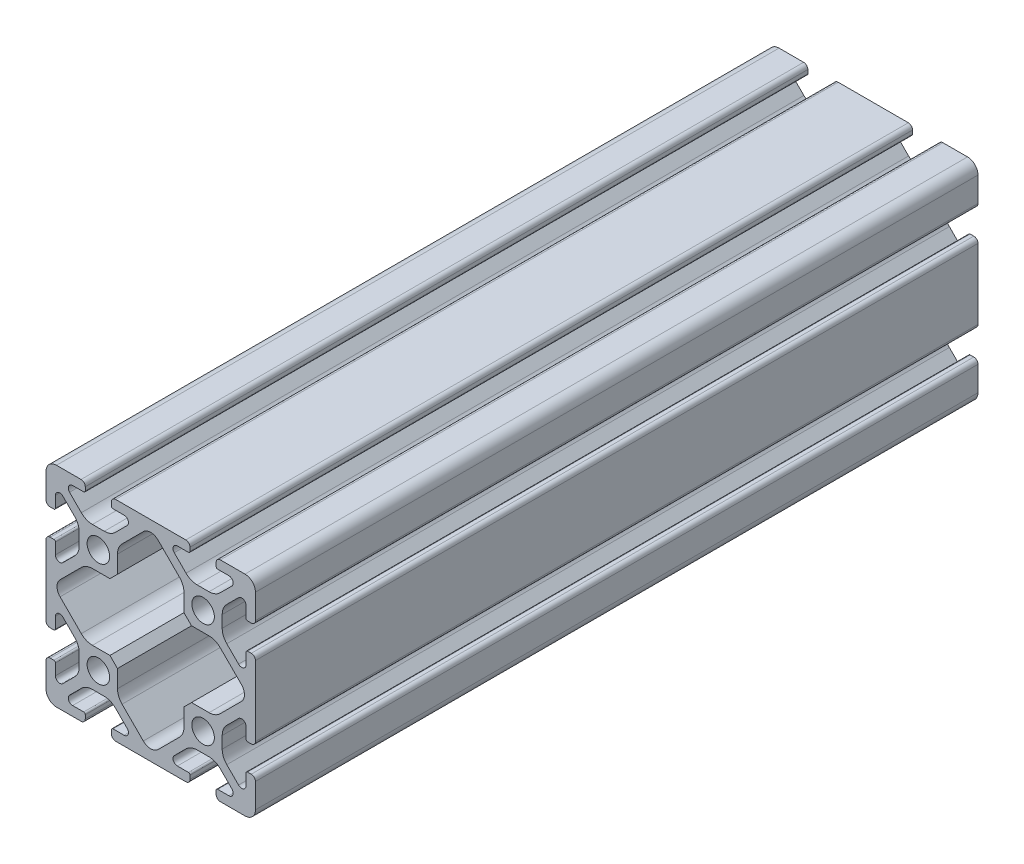
from build123d import *

# Parameters (mm, degrees)
ESQUISSE1_R      = 2.15
EXTRUSION1_DEPTH = 138


with BuildPart() as part:
    # Esquisse1 → Extrusion1 (new body)
    with BuildSketch(Plane(origin=(0, 0, 0), x_dir=(-1, 0, 0), z_dir=(0, 0, -1))):
        with BuildLine():
            Line((0, 13.3), (0, 26.7))
            ThreePointArc((0, 26.7), (-0.234314575, 27.265685425), (-0.8, 27.5))
            Line((-0.8, 27.5), (-1.5, 27.5))
            ThreePointArc((-1.5, 27.5), (-1.712132034, 27.412132034), (-1.8, 27.2))
            Line((-1.8, 27.2), (-1.8, 25.081575939))
            ThreePointArc((-1.8, 25.081575939), (-2.313345604, 24.313299949), (-3.219588924, 24.493562953))
            Line((-3.219588924, 24.493562953), (-5.471320344, 26.745294373))
            ThreePointArc((-5.471320344, 26.745294373), (-6.121638598, 27.718564419), (-6.35, 28.866614716))
            Line((-6.35, 28.866614716), (-6.35, 31.133385284))
            ThreePointArc((-6.35, 31.133385284), (-6.121638598, 32.281435581), (-5.471320344, 33.254705627))
            Line((-5.471320344, 33.254705627), (-3.219588924, 35.506437047))
            ThreePointArc((-3.219588924, 35.506437047), (-2.313345604, 35.686700051), (-1.8, 34.918424061))
            Line((-1.8, 34.918424061), (-1.8, 32.8))
            ThreePointArc((-1.8, 32.8), (-1.712132034, 32.587867966), (-1.5, 32.5))
            Line((-1.5, 32.5), (-0.8, 32.5))
            ThreePointArc((-0.8, 32.5), (-0.234314575, 32.734314575), (0, 33.3))
            Line((0, 33.3), (0, 38))
            ThreePointArc((0, 38), (-0.585786438, 39.414213562), (-2, 40))
            Line((-2, 40), (-6.7, 40))
            ThreePointArc((-6.7, 40), (-7.265685425, 39.765685425), (-7.5, 39.2))
            Line((-7.5, 39.2), (-7.5, 38.5))
            ThreePointArc((-7.5, 38.5), (-7.412132034, 38.287867966), (-7.2, 38.2))
            Line((-7.2, 38.2), (-5.081575939, 38.2))
            ThreePointArc((-5.081575939, 38.2), (-4.313299949, 37.686654396), (-4.493562953, 36.780411076))
            Line((-4.493562953, 36.780411076), (-6.745294373, 34.528679656))
            ThreePointArc((-6.745294373, 34.528679656), (-7.718564419, 33.878361402), (-8.866614716, 33.65))
            Line((-8.866614716, 33.65), (-11.133385284, 33.65))
            ThreePointArc((-11.133385284, 33.65), (-12.281435581, 33.878361402), (-13.254705627, 34.528679656))
            Line((-13.254705627, 34.528679656), (-15.506437047, 36.780411076))
            ThreePointArc((-15.506437047, 36.780411076), (-15.686700051, 37.686654396), (-14.918424061, 38.2))
            Line((-14.918424061, 38.2), (-12.8, 38.2))
            ThreePointArc((-12.8, 38.2), (-12.587867966, 38.287867966), (-12.5, 38.5))
            Line((-12.5, 38.5), (-12.5, 39.2))
            ThreePointArc((-12.5, 39.2), (-12.734314575, 39.765685425), (-13.3, 40))
            Line((-13.3, 40), (-26.7, 40))
            ThreePointArc((-26.7, 40), (-27.265685425, 39.765685425), (-27.5, 39.2))
            Line((-27.5, 39.2), (-27.5, 38.5))
            ThreePointArc((-27.5, 38.5), (-27.412132034, 38.287867966), (-27.2, 38.2))
            Line((-27.2, 38.2), (-25.081575939, 38.2))
            ThreePointArc((-25.081575939, 38.2), (-24.313299949, 37.686654396), (-24.493562953, 36.780411076))
            Line((-24.493562953, 36.780411076), (-26.745294373, 34.528679656))
            ThreePointArc((-26.745294373, 34.528679656), (-27.718564419, 33.878361402), (-28.866614716, 33.65))
            Line((-28.866614716, 33.65), (-31.133385284, 33.65))
            ThreePointArc((-31.133385284, 33.65), (-32.281435581, 33.878361402), (-33.254705627, 34.528679656))
            Line((-33.254705627, 34.528679656), (-35.506437047, 36.780411076))
            ThreePointArc((-35.506437047, 36.780411076), (-35.686700051, 37.686654396), (-34.918424061, 38.2))
            Line((-34.918424061, 38.2), (-32.8, 38.2))
            ThreePointArc((-32.8, 38.2), (-32.587867966, 38.287867966), (-32.5, 38.5))
            Line((-32.5, 38.5), (-32.5, 39.2))
            ThreePointArc((-32.5, 39.2), (-32.734314575, 39.765685425), (-33.3, 40))
            Line((-33.3, 40), (-38, 40))
            ThreePointArc((-38, 40), (-39.414213562, 39.414213562), (-40, 38))
            Line((-40, 38), (-40, 33.3))
            ThreePointArc((-40, 33.3), (-39.765685425, 32.734314575), (-39.2, 32.5))
            Line((-39.2, 32.5), (-38.5, 32.5))
            ThreePointArc((-38.5, 32.5), (-38.287867966, 32.587867966), (-38.2, 32.8))
            Line((-38.2, 32.8), (-38.2, 34.918424061))
            ThreePointArc((-38.2, 34.918424061), (-37.686654396, 35.686700051), (-36.780411076, 35.506437047))
            Line((-36.780411076, 35.506437047), (-34.528679656, 33.254705627))
            ThreePointArc((-34.528679656, 33.254705627), (-33.878361402, 32.281435581), (-33.65, 31.133385284))
            Line((-33.65, 31.133385284), (-33.65, 28.866614716))
            ThreePointArc((-33.65, 28.866614716), (-33.878361402, 27.718564419), (-34.528679656, 26.745294373))
            Line((-34.528679656, 26.745294373), (-36.780411076, 24.493562953))
            ThreePointArc((-36.780411076, 24.493562953), (-37.686654396, 24.313299949), (-38.2, 25.081575939))
            Line((-38.2, 25.081575939), (-38.2, 27.2))
            ThreePointArc((-38.2, 27.2), (-38.287867966, 27.412132034), (-38.5, 27.5))
            Line((-38.5, 27.5), (-39.2, 27.5))
            ThreePointArc((-39.2, 27.5), (-39.765685425, 27.265685425), (-40, 26.7))
            Line((-40, 26.7), (-40, 13.3))
            ThreePointArc((-40, 13.3), (-39.765685425, 12.734314575), (-39.2, 12.5))
            Line((-39.2, 12.5), (-38.5, 12.5))
            ThreePointArc((-38.5, 12.5), (-38.287867966, 12.587867966), (-38.2, 12.8))
            Line((-38.2, 12.8), (-38.2, 14.918424061))
            ThreePointArc((-38.2, 14.918424061), (-37.686654396, 15.686700051), (-36.780411076, 15.506437047))
            Line((-36.780411076, 15.506437047), (-34.528679656, 13.254705627))
            ThreePointArc((-34.528679656, 13.254705627), (-33.878361402, 12.281435581), (-33.65, 11.133385284))
            Line((-33.65, 11.133385284), (-33.65, 8.866614716))
            ThreePointArc((-33.65, 8.866614716), (-33.878361402, 7.718564419), (-34.528679656, 6.745294373))
            Line((-34.528679656, 6.745294373), (-36.780411076, 4.493562953))
            ThreePointArc((-36.780411076, 4.493562953), (-37.686654396, 4.313299949), (-38.2, 5.081575939))
            Line((-38.2, 5.081575939), (-38.2, 7.2))
            ThreePointArc((-38.2, 7.2), (-38.287867966, 7.412132034), (-38.5, 7.5))
            Line((-38.5, 7.5), (-39.2, 7.5))
            ThreePointArc((-39.2, 7.5), (-39.765685425, 7.265685425), (-40, 6.7))
            Line((-40, 6.7), (-40, 2))
            ThreePointArc((-40, 2), (-39.414213562, 0.585786438), (-38, 0))
            Line((-38, 0), (-33.3, 0))
            ThreePointArc((-33.3, 0), (-32.734314575, 0.234314575), (-32.5, 0.8))
            Line((-32.5, 0.8), (-32.5, 1.5))
            ThreePointArc((-32.5, 1.5), (-32.587867966, 1.712132034), (-32.8, 1.8))
            Line((-32.8, 1.8), (-34.918424061, 1.8))
            ThreePointArc((-34.918424061, 1.8), (-35.686700051, 2.313345604), (-35.506437047, 3.219588924))
            Line((-35.506437047, 3.219588924), (-33.254705627, 5.471320344))
            ThreePointArc((-33.254705627, 5.471320344), (-32.281435581, 6.121638598), (-31.133385284, 6.35))
            Line((-31.133385284, 6.35), (-28.866614716, 6.35))
            ThreePointArc((-28.866614716, 6.35), (-27.718564419, 6.121638598), (-26.745294373, 5.471320344))
            Line((-26.745294373, 5.471320344), (-24.493562953, 3.219588924))
            ThreePointArc((-24.493562953, 3.219588924), (-24.313299949, 2.313345604), (-25.081575939, 1.8))
            Line((-25.081575939, 1.8), (-27.2, 1.8))
            ThreePointArc((-27.2, 1.8), (-27.412132034, 1.712132034), (-27.5, 1.5))
            Line((-27.5, 1.5), (-27.5, 0.8))
            ThreePointArc((-27.5, 0.8), (-27.265685425, 0.234314575), (-26.7, 0))
            Line((-26.7, 0), (-13.3, 0))
            ThreePointArc((-13.3, 0), (-12.734314575, 0.234314575), (-12.5, 0.8))
            Line((-12.5, 0.8), (-12.5, 1.5))
            ThreePointArc((-12.5, 1.5), (-12.587867966, 1.712132034), (-12.8, 1.8))
            Line((-12.8, 1.8), (-14.918424061, 1.8))
            ThreePointArc((-14.918424061, 1.8), (-15.686700051, 2.313345604), (-15.506437047, 3.219588924))
            Line((-15.506437047, 3.219588924), (-13.254705627, 5.471320344))
            ThreePointArc((-13.254705627, 5.471320344), (-12.281435581, 6.121638598), (-11.133385284, 6.35))
            Line((-11.133385284, 6.35), (-8.866614716, 6.35))
            ThreePointArc((-8.866614716, 6.35), (-7.718564419, 6.121638598), (-6.745294373, 5.471320344))
            Line((-6.745294373, 5.471320344), (-4.493562953, 3.219588924))
            ThreePointArc((-4.493562953, 3.219588924), (-4.313299949, 2.313345604), (-5.081575939, 1.8))
            Line((-5.081575939, 1.8), (-7.2, 1.8))
            ThreePointArc((-7.2, 1.8), (-7.412132034, 1.712132034), (-7.5, 1.5))
            Line((-7.5, 1.5), (-7.5, 0.8))
            ThreePointArc((-7.5, 0.8), (-7.265685425, 0.234314575), (-6.7, 0))
            Line((-6.7, 0), (-2, 0))
            ThreePointArc((-2, 0), (-0.585786438, 0.585786438), (0, 2))
            Line((0, 2), (0, 6.7))
            ThreePointArc((0, 6.7), (-0.234314575, 7.265685425), (-0.8, 7.5))
            Line((-0.8, 7.5), (-1.5, 7.5))
            ThreePointArc((-1.5, 7.5), (-1.712132034, 7.412132034), (-1.8, 7.2))
            Line((-1.8, 7.2), (-1.8, 5.081575939))
            ThreePointArc((-1.8, 5.081575939), (-2.313345604, 4.313299949), (-3.219588924, 4.493562953))
            Line((-3.219588924, 4.493562953), (-5.471320344, 6.745294373))
            ThreePointArc((-5.471320344, 6.745294373), (-6.121638598, 7.718564419), (-6.35, 8.866614716))
            Line((-6.35, 8.866614716), (-6.35, 11.133385284))
            ThreePointArc((-6.35, 11.133385284), (-6.121638598, 12.281435581), (-5.471320344, 13.254705627))
            Line((-5.471320344, 13.254705627), (-3.219588924, 15.506437047))
            ThreePointArc((-3.219588924, 15.506437047), (-2.313345604, 15.686700051), (-1.8, 14.918424061))
            Line((-1.8, 14.918424061), (-1.8, 12.8))
            ThreePointArc((-1.8, 12.8), (-1.712132034, 12.587867966), (-1.5, 12.5))
            Line((-1.5, 12.5), (-0.8, 12.5))
            ThreePointArc((-0.8, 12.5), (-0.234314575, 12.734314575), (0, 13.3))
        make_face()
        with Locations(Location((-10, 10, 0), (0, 0, 180))):
            Circle(ESQUISSE1_R, mode=Mode.SUBTRACT)
        with Locations(Location((-10, 30, 0), (0, 0, 180))):
            Circle(ESQUISSE1_R, mode=Mode.SUBTRACT)
        with Locations(Location((-30, 10, 0), (0, 0, 180))):
            Circle(ESQUISSE1_R, mode=Mode.SUBTRACT)
        with Locations(Location((-30, 30, 0), (0, 0, 180))):
            Circle(ESQUISSE1_R, mode=Mode.SUBTRACT)
        with BuildLine():
            Line((-12.207864344, 13.650000344), (-13.649999344, 12.207864344))
            Line((-13.649999344, 12.207864344), (-13.649999344, 8.865434344))
            ThreePointArc((-13.649999344, 8.865434344), (-13.878360746, 7.717384046), (-14.528679, 6.744114))
            Line((-14.528679, 6.744114), (-18.585787, 2.687006))
            ThreePointArc((-18.585787, 2.687006), (-20.000000562, 2.101219562), (-21.414214125, 2.687006))
            Line((-21.414214125, 2.687006), (-25.471320625, 6.7441125))
            ThreePointArc((-25.471320625, 6.7441125), (-26.121638879, 7.717382546), (-26.350000281, 8.865432844))
            Line((-26.350000281, 8.865432844), (-26.350000281, 12.207864844))
            Line((-26.350000281, 12.207864844), (-27.071068281, 12.928932844))
            Line((-27.071068281, 12.928932844), (-27.792135781, 13.650000344))
            Line((-27.792135781, 13.650000344), (-31.134567781, 13.650000344))
            ThreePointArc((-31.134567781, 13.650000344), (-32.282618078, 13.878361746), (-33.255888125, 14.52868))
            Line((-33.255888125, 14.52868), (-37.312995125, 18.585787))
            ThreePointArc((-37.312995125, 18.585787), (-37.898781562, 20.000000686), (-37.31299495, 21.414214299))
            Line((-37.31299495, 21.414214299), (-33.255887863, 25.471320386))
            ThreePointArc((-33.255887863, 25.471320386), (-32.282617907, 26.121638449), (-31.134567781, 26.349999781))
            Line((-31.134567781, 26.349999781), (-27.792134781, 26.349999781))
            Line((-27.792134781, 26.349999781), (-27.071067781, 27.071067781))
            Line((-27.071067781, 27.071067781), (-26.350000281, 27.792136281))
            Line((-26.350000281, 27.792136281), (-26.350000281, 31.134565362))
            ThreePointArc((-26.350000281, 31.134565362), (-26.121638808, 32.28261583), (-25.471320363, 33.255885967))
            Line((-25.471320363, 33.255885967), (-21.414212991, 37.31299234))
            ThreePointArc((-21.414212991, 37.31299234), (-19.999999603, 37.898778603), (-18.585786215, 37.31299234))
            Line((-18.585786215, 37.31299234), (-14.528679261, 33.255886386))
            ThreePointArc((-14.528679261, 33.255886386), (-13.878360817, 32.282616249), (-13.649999344, 31.134565781))
            Line((-13.649999344, 31.134565781), (-13.649999344, 27.792135781))
            Line((-13.649999344, 27.792135781), (-12.207863344, 26.349999781))
            Line((-12.207863344, 26.349999781), (-8.865431425, 26.349999781))
            ThreePointArc((-8.865431425, 26.349999781), (-7.717381299, 26.121638449), (-6.744111343, 25.471320386))
            Line((-6.744111343, 25.471320386), (-2.687005215, 21.414215258))
            ThreePointArc((-2.687005215, 21.414215258), (-2.101218603, 20.000001645), (-2.687005041, 18.585787959))
            Line((-2.687005041, 18.585787959), (-6.744113, 14.52868))
            ThreePointArc((-6.744113, 14.52868), (-7.717383046, 13.878361746), (-8.865433344, 13.650000344))
            Line((-8.865433344, 13.650000344), (-12.207864344, 13.650000344))
        make_face(mode=Mode.SUBTRACT)
    extrude(amount=-EXTRUSION1_DEPTH)


solid = part.part
